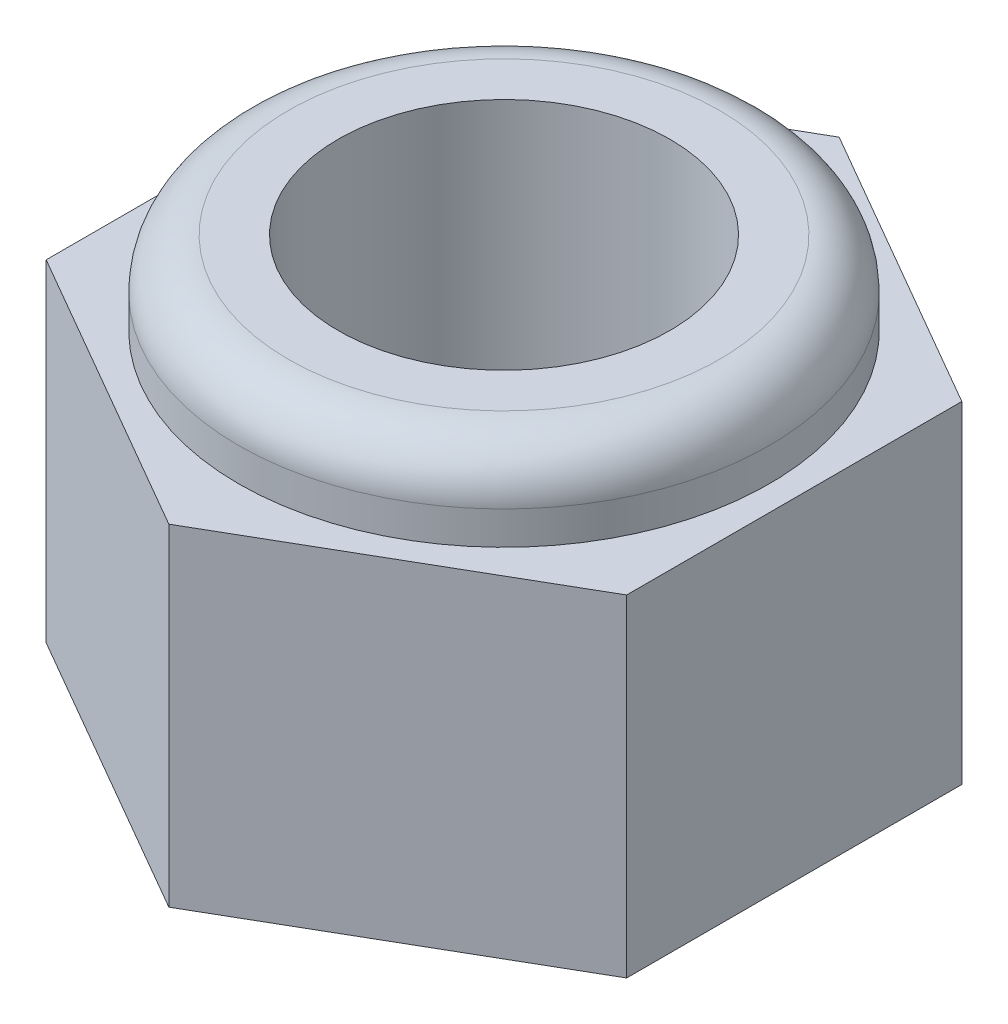
from build123d import *

# Parameters (mm, degrees)
BOSS_EXTRUDE1_DEPTH = 4
CUT_EXTRUDE1_REACH  = 9.32
SKETCH4_R           = 2


with BuildPart() as part:
    # Sketch1 → Boss-Extrude1 (new body)
    with BuildSketch(Plane(origin=(0, 0, 0), x_dir=(1, 0, 0), z_dir=(0, 1, 0))):
        Polygon((0, 4.041451884), (-3.5, 2.020725942), (-3.5, -2.020725942), (0, -4.041451884), (3.5, -2.020725942), (3.5, 2.020725942), align=None)
    extrude(amount=BOSS_EXTRUDE1_DEPTH)

    # Sketch2 → Revolve1 (revolve)
    with BuildSketch(Plane.XY, mode=Mode.PRIVATE) as revolve1_sk:
        with BuildLine():
            Line((0, 5), (0, 4))
            Line((0, 4), (3.2, 4))
            Line((3.2, 4), (3.2, 4.4))
            ThreePointArc((3.2, 4.4), (3.024264069, 4.824264069), (2.6, 5))
            Line((2.6, 5), (0, 5))
        make_face()
    revolve(revolve1_sk.sketch.rotate(Axis((0, 0, 0), (0, 1, 0)), 90), axis=Axis((0, 0, 0), (0, 1, 0)))

    # Sketch4 → Cut-Extrude1 (cut, up to next)
    with BuildSketch(Plane.XZ, mode=Mode.PRIVATE) as cut_extrude1_sk1:
        with Locations(Location((0, 0, 0), (0, 0, 270))):
            Circle(SKETCH4_R)
    cut_extrude1_tool1 = extrude(cut_extrude1_sk1.sketch, amount=-CUT_EXTRUDE1_REACH, mode=Mode.PRIVATE) & part.part
    add(cut_extrude1_tool1.solids().sort_by_distance((0, 0, 0))[0], mode=Mode.SUBTRACT)


solid = part.part
